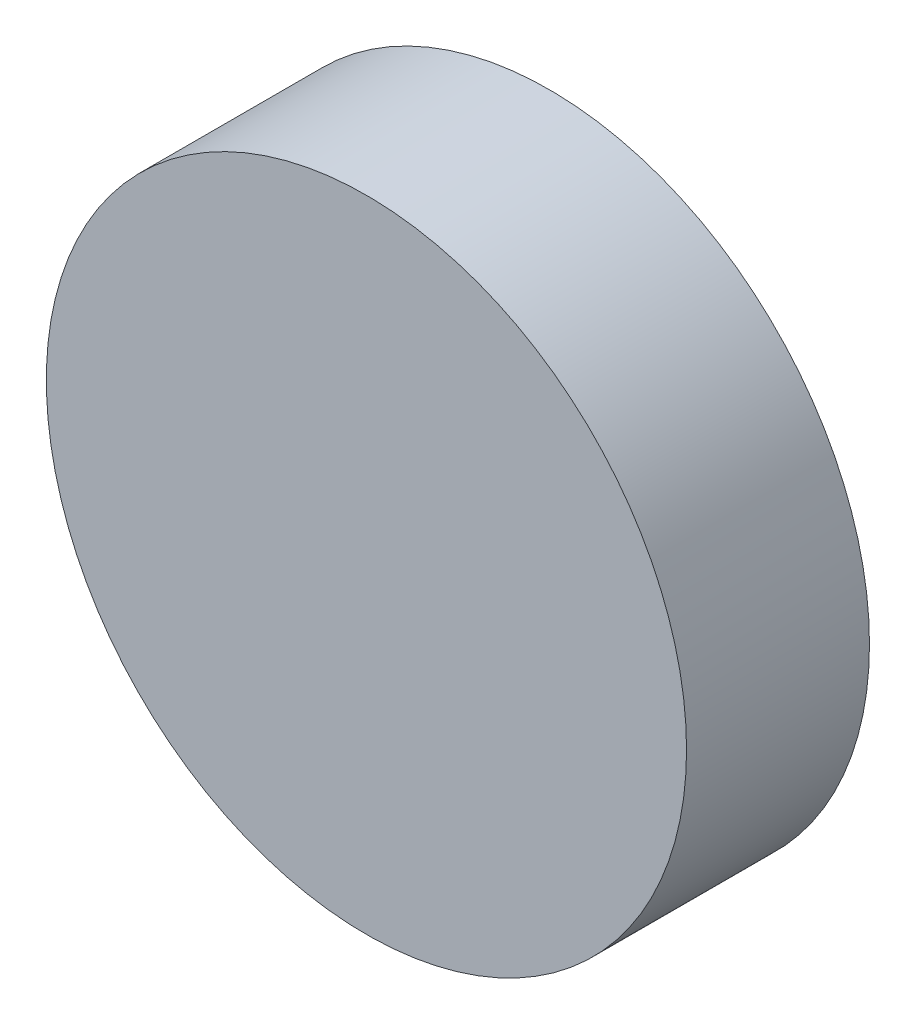
from build123d import *

# Parameters (mm, degrees)
SKETCH1_R           = 17.5
BOSS_EXTRUDE1_DEPTH = 10


with BuildPart() as part:
    # Sketch1 → Boss-Extrude1 (new body)
    with BuildSketch(Plane.XY):
        Circle(SKETCH1_R)
    extrude(amount=BOSS_EXTRUDE1_DEPTH)


solid = part.part
